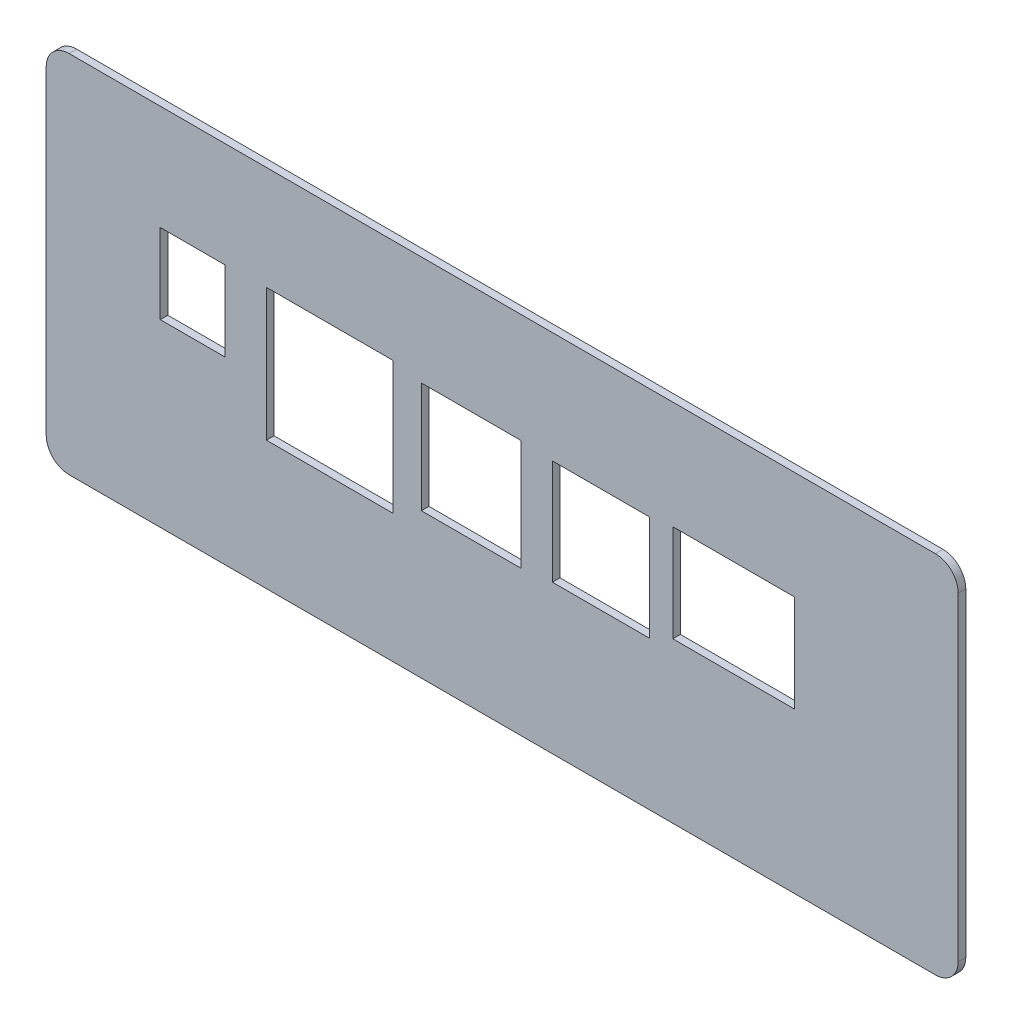
from build123d import *

# Parameters (mm, degrees)
SKETCH1_W           = 13.101477715
SKETCH1_H           = 14.558194743
SKETCH1_W_2         = 8.5
SKETCH1_H_2         = 10.5
SKETCH1_W_3         = 16.678859494
SKETCH1_H_3         = 17.418317903
SKETCH1_W_4         = 15.995214615
SKETCH1_H_4         = 12.7738
SKETCH1_W_5         = 12.8
SKETCH1_H_5         = 13.82
BOSS_EXTRUDE1_DEPTH = 1


with BuildPart() as part:
    # Sketch1 → Boss-Extrude1 (new body)
    with BuildSketch(Plane.XY):
        with BuildLine():
            Line((-51.940144553, -23.805569529), (62.059855447, -23.805569529))
            ThreePointArc((62.059855447, -23.805569529), (64.18117579, -22.926889873), (65.059855447, -20.805569529))
            Line((65.059855447, -20.805569529), (65.059855447, 0.194430471))
            Line((65.059855447, 0.194430471), (65.059855447, 21.194430471))
            ThreePointArc((65.059855447, 21.194430471), (64.18117579, 23.315750814), (62.059855447, 24.194430471))
            Line((62.059855447, 24.194430471), (-51.940144553, 24.194430471))
            ThreePointArc((-51.940144553, 24.194430471), (-54.061464897, 23.315750814), (-54.940144553, 21.194430471))
            Line((-54.940144553, 21.194430471), (-54.940144553, 0.194430471))
            Line((-54.940144553, 0.194430471), (-54.940144553, -20.805569529))
            ThreePointArc((-54.940144553, -20.805569529), (-54.061464897, -22.926889873), (-51.940144553, -23.805569529))
        make_face()
        with Locations((0.968394625, 2.55037109)):
            Rectangle(SKETCH1_W, SKETCH1_H, mode=Mode.SUBTRACT)
        with Locations((-35.690144553, 5.119430471)):
            Rectangle(SKETCH1_W_2, SKETCH1_H_2, mode=Mode.SUBTRACT)
        with Locations((-17.6295743, 1.82407152)):
            Rectangle(SKETCH1_W_3, SKETCH1_H_3, mode=Mode.SUBTRACT)
        with Locations((35.50746287, 3.606330471)):
            Rectangle(SKETCH1_W_4, SKETCH1_H_4, mode=Mode.SUBTRACT)
        with Locations((18.059855447, 2.659430471)):
            Rectangle(SKETCH1_W_5, SKETCH1_H_5, mode=Mode.SUBTRACT)
    extrude(amount=BOSS_EXTRUDE1_DEPTH)


solid = part.part
